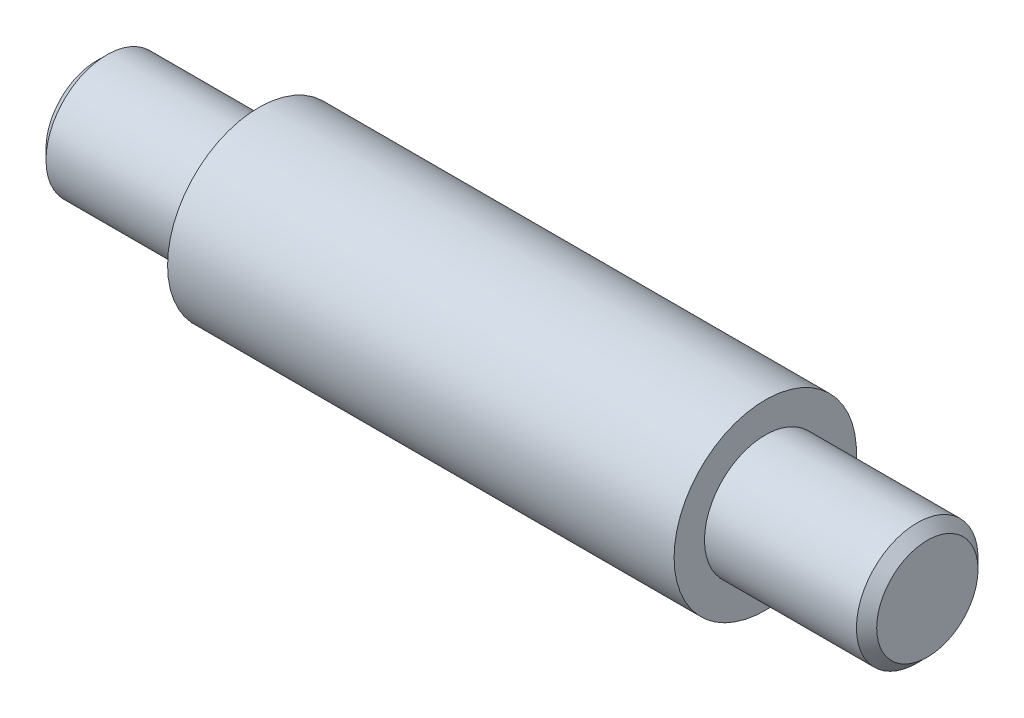
from build123d import *


with BuildPart() as part:
    # Sketch1 → Revolve1 (revolve)
    with BuildSketch(Plane.XY, mode=Mode.PRIVATE) as revolve1_sk:
        Polygon((40, 6), (41, 5), (41, 0), (-41, 0), (-41, 5), (-40, 6), (-25, 6), (-25, 9), (25, 9), (25, 6), align=None)
    revolve(revolve1_sk.sketch.rotate(Axis((0, 0, 0), (1, 0, 0)), 90), axis=Axis((0, 0, 0), (1, 0, 0)))


solid = part.part
